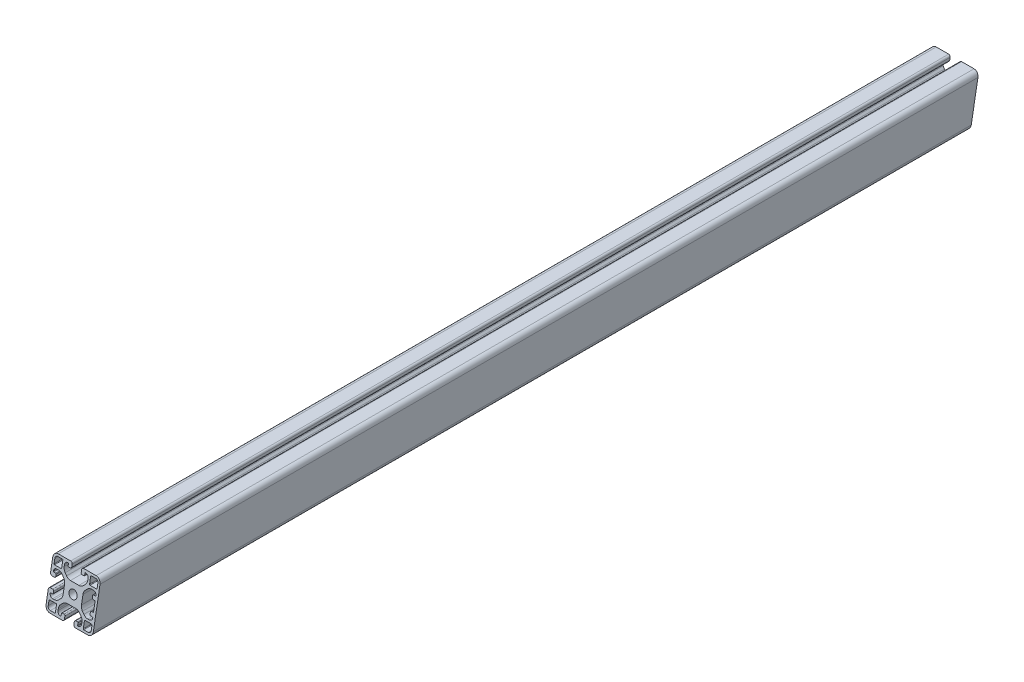
from build123d import *

# Parameters (mm, degrees)
SCHIZZO1_R                   = 3.4
ESTRUSIONE_ESTRUSIONE1_DEPTH = 750
TAGLIO_ESTRUSIONE4_DEPTH     = 413.431812546


with BuildPart() as part:
    # Schizzo1 → Estrusione-Estrusione1 (new body)
    with BuildSketch(Plane(origin=(0, 0, -340), x_dir=(-1, 0, 0), z_dir=(0, 0, -1))):
        with BuildLine():
            Line((6.5, -15.5), (5, -15.5))
            ThreePointArc((5, -15.5), (4.292893219, -15.792893219), (4, -16.5))
            Line((4, -16.5), (4, -18.5))
            ThreePointArc((4, -18.5), (4.439339828, -19.560660172), (5.5, -20))
            Line((5.5, -20), (16, -20))
            ThreePointArc((16, -20), (18.828427125, -18.828427125), (20, -16))
            Line((20, -16), (20, -5.5))
            ThreePointArc((20, -5.5), (19.560660172, -4.439339828), (18.5, -4))
            Line((18.5, -4), (16.5, -4))
            ThreePointArc((16.5, -4), (15.792893219, -4.292893219), (15.5, -5))
            Line((15.5, -5), (15.5, -6.5))
            ThreePointArc((15.5, -6.5), (15.646446609, -6.853553391), (16, -7))
            Line((16, -7), (17.55, -7))
            ThreePointArc((17.55, -7), (17.868198052, -7.131801948), (18, -7.45))
            Line((18, -7.45), (18, -7.5))
            ThreePointArc((18, -7.5), (17.267766953, -9.267766953), (15.5, -10))
            Line((15.5, -10), (14.192388155, -10))
            ThreePointArc((14.192388155, -10), (12.278970994, -9.619397663), (10.656854249, -8.535533906))
            Line((10.656854249, -8.535533906), (9.214466094, -7.09314575))
            ThreePointArc((9.214466094, -7.09314575), (8.130602337, -5.471029006), (7.75, -3.557611845))
            Line((7.75, -3.557611845), (7.75, 3.557611845))
            ThreePointArc((7.75, 3.557611845), (8.130602337, 5.471029006), (9.214466094, 7.09314575))
            Line((9.214466094, 7.09314575), (10.656854249, 8.535533906))
            ThreePointArc((10.656854249, 8.535533906), (12.278970994, 9.619397663), (14.192388155, 10))
            Line((14.192388155, 10), (15.5, 10))
            ThreePointArc((15.5, 10), (17.267766953, 9.267766953), (18, 7.5))
            Line((18, 7.5), (18, 7.45))
            ThreePointArc((18, 7.45), (17.868198052, 7.131801948), (17.55, 7))
            Line((17.55, 7), (16, 7))
            ThreePointArc((16, 7), (15.646446609, 6.853553391), (15.5, 6.5))
            Line((15.5, 6.5), (15.5, 5))
            ThreePointArc((15.5, 5), (15.792893219, 4.292893219), (16.5, 4))
            Line((16.5, 4), (18.5, 4))
            ThreePointArc((18.5, 4), (19.560660172, 4.439339828), (20, 5.5))
            Line((20, 5.5), (20, 16))
            ThreePointArc((20, 16), (18.828427125, 18.828427125), (16, 20))
            Line((16, 20), (5.5, 20))
            ThreePointArc((5.5, 20), (4.439339828, 19.560660172), (4, 18.5))
            Line((4, 18.5), (4, 16.5))
            ThreePointArc((4, 16.5), (4.292893219, 15.792893219), (5, 15.5))
            Line((5, 15.5), (6.5, 15.5))
            ThreePointArc((6.5, 15.5), (6.853553391, 15.646446609), (7, 16))
            Line((7, 16), (7, 17.55))
            ThreePointArc((7, 17.55), (7.131801948, 17.868198052), (7.45, 18))
            Line((7.45, 18), (7.5, 18))
            ThreePointArc((7.5, 18), (9.267766953, 17.267766953), (10, 15.5))
            Line((10, 15.5), (10, 14.192388155))
            ThreePointArc((10, 14.192388155), (9.619397663, 12.278970994), (8.535533906, 10.656854249))
            Line((8.535533906, 10.656854249), (7.09314575, 9.214466094))
            ThreePointArc((7.09314575, 9.214466094), (5.471029006, 8.130602337), (3.557611844, 7.75))
            Line((3.557611844, 7.75), (-3.557611845, 7.75))
            ThreePointArc((-3.557611845, 7.75), (-5.471029006, 8.130602337), (-7.09314575, 9.214466094))
            Line((-7.09314575, 9.214466094), (-8.535533906, 10.656854249))
            ThreePointArc((-8.535533906, 10.656854249), (-9.619397663, 12.278970994), (-10, 14.192388155))
            Line((-10, 14.192388155), (-10, 15.5))
            ThreePointArc((-10, 15.5), (-9.267766953, 17.267766953), (-7.5, 18))
            Line((-7.5, 18), (-7.45, 18))
            ThreePointArc((-7.45, 18), (-7.131801948, 17.868198052), (-7, 17.55))
            Line((-7, 17.55), (-7, 16))
            ThreePointArc((-7, 16), (-6.853553391, 15.646446609), (-6.5, 15.5))
            Line((-6.5, 15.5), (-5, 15.5))
            ThreePointArc((-5, 15.5), (-4.292893219, 15.792893219), (-4, 16.5))
            Line((-4, 16.5), (-4, 18.5))
            ThreePointArc((-4, 18.5), (-4.439339828, 19.560660172), (-5.5, 20))
            Line((-5.5, 20), (-16, 20))
            ThreePointArc((-16, 20), (-18.828427125, 18.828427125), (-20, 16))
            Line((-20, 16), (-20, -16))
            ThreePointArc((-20, -16), (-18.828427125, -18.828427125), (-16, -20))
            Line((-16, -20), (-5.5, -20))
            ThreePointArc((-5.5, -20), (-4.439339828, -19.560660172), (-4, -18.5))
            Line((-4, -18.5), (-4, -16.5))
            ThreePointArc((-4, -16.5), (-4.292893219, -15.792893219), (-5, -15.5))
            Line((-5, -15.5), (-6.5, -15.5))
            ThreePointArc((-6.5, -15.5), (-6.853553391, -15.646446609), (-7, -16))
            Line((-7, -16), (-7, -17.55))
            ThreePointArc((-7, -17.55), (-7.131801948, -17.868198052), (-7.45, -18))
            Line((-7.45, -18), (-7.5, -18))
            ThreePointArc((-7.5, -18), (-9.267766953, -17.267766953), (-10, -15.5))
            Line((-10, -15.5), (-10, -14.192388155))
            ThreePointArc((-10, -14.192388155), (-9.619397663, -12.278970994), (-8.535533906, -10.656854249))
            Line((-8.535533906, -10.656854249), (-7.09314575, -9.214466094))
            ThreePointArc((-7.09314575, -9.214466094), (-5.471029006, -8.130602337), (-3.557611845, -7.75))
            Line((-3.557611845, -7.75), (3.557611845, -7.75))
            ThreePointArc((3.557611845, -7.75), (5.471029006, -8.130602337), (7.09314575, -9.214466094))
            Line((7.09314575, -9.214466094), (8.535533906, -10.656854249))
            ThreePointArc((8.535533906, -10.656854249), (9.619397663, -12.278970994), (10, -14.192388155))
            Line((10, -14.192388155), (10, -15.5))
            ThreePointArc((10, -15.5), (9.267766953, -17.267766953), (7.5, -18))
            Line((7.5, -18), (7.45, -18))
            ThreePointArc((7.45, -18), (7.131801948, -17.868198052), (7, -17.55))
            Line((7, -17.55), (7, -16))
            ThreePointArc((7, -16), (6.853553391, -15.646446609), (6.5, -15.5))
        make_face()
        with Locations(Location((0, 0, 0), (0, 0, 180))):
            Circle(SCHIZZO1_R, mode=Mode.SUBTRACT)
        with BuildLine():
            Line((-12.3, -18.2), (-16, -18.2))
            ThreePointArc((-16, -18.2), (-17.555634919, -17.555634919), (-18.2, -16))
            Line((-18.2, -16), (-18.2, -12.3))
            ThreePointArc((-18.2, -12.3), (-18.053553391, -11.946446609), (-17.7, -11.8))
            Line((-17.7, -11.8), (-12.3, -11.8))
            ThreePointArc((-12.3, -11.8), (-11.946446609, -11.946446609), (-11.8, -12.3))
            Line((-11.8, -12.3), (-11.8, -17.7))
            ThreePointArc((-11.8, -17.7), (-11.946446609, -18.053553391), (-12.3, -18.2))
        make_face(mode=Mode.SUBTRACT)
        with BuildLine():
            Line((-11.8, 17.7), (-11.8, 12.3))
            ThreePointArc((-11.8, 12.3), (-11.946446609, 11.946446609), (-12.3, 11.8))
            Line((-12.3, 11.8), (-17.7, 11.8))
            ThreePointArc((-17.7, 11.8), (-18.053553391, 11.946446609), (-18.2, 12.3))
            Line((-18.2, 12.3), (-18.2, 16))
            ThreePointArc((-18.2, 16), (-17.555634919, 17.555634919), (-16, 18.2))
            Line((-16, 18.2), (-12.3, 18.2))
            ThreePointArc((-12.3, 18.2), (-11.946446609, 18.053553391), (-11.8, 17.7))
        make_face(mode=Mode.SUBTRACT)
        with BuildLine():
            Line((18.2, 16), (18.2, 12.3))
            ThreePointArc((18.2, 12.3), (18.053553391, 11.946446609), (17.7, 11.8))
            Line((17.7, 11.8), (12.3, 11.8))
            ThreePointArc((12.3, 11.8), (11.946446609, 11.946446609), (11.8, 12.3))
            Line((11.8, 12.3), (11.8, 17.7))
            ThreePointArc((11.8, 17.7), (11.946446609, 18.053553391), (12.3, 18.2))
            Line((12.3, 18.2), (16, 18.2))
            ThreePointArc((16, 18.2), (17.555634919, 17.555634919), (18.2, 16))
        make_face(mode=Mode.SUBTRACT)
        with BuildLine():
            Line((18.2, -12.3), (18.2, -16))
            ThreePointArc((18.2, -16), (17.555634919, -17.555634919), (16, -18.2))
            Line((16, -18.2), (12.3, -18.2))
            ThreePointArc((12.3, -18.2), (11.946446609, -18.053553391), (11.8, -17.7))
            Line((11.8, -17.7), (11.8, -12.3))
            ThreePointArc((11.8, -12.3), (11.946446609, -11.946446609), (12.3, -11.8))
            Line((12.3, -11.8), (17.7, -11.8))
            ThreePointArc((17.7, -11.8), (18.053553391, -11.946446609), (18.2, -12.3))
        make_face(mode=Mode.SUBTRACT)
        with BuildLine():
            Line((-16, 7), (-17.5, 7))
            ThreePointArc((-17.5, 7), (-17.853553391, 7.146446609), (-18, 7.5))
            ThreePointArc((-18, 7.5), (-17.267766953, 9.267766953), (-15.5, 10))
            Line((-15.5, 10), (-14.192388155, 10))
            ThreePointArc((-14.192388155, 10), (-12.278970994, 9.619397663), (-10.656854249, 8.535533906))
            Line((-10.656854249, 8.535533906), (-9.214466094, 7.093145751))
            ThreePointArc((-9.214466094, 7.093145751), (-8.130602337, 5.471029006), (-7.75, 3.557611845))
            Line((-7.75, 3.557611845), (-7.75, -3.557611845))
            ThreePointArc((-7.75, -3.557611845), (-8.130602337, -5.471029006), (-9.214466094, -7.093145751))
            Line((-9.214466094, -7.093145751), (-10.656854249, -8.535533906))
            ThreePointArc((-10.656854249, -8.535533906), (-12.278970994, -9.619397663), (-14.192388155, -10))
            Line((-14.192388155, -10), (-15.5, -10))
            ThreePointArc((-15.5, -10), (-17.267766953, -9.267766953), (-18, -7.5))
            ThreePointArc((-18, -7.5), (-17.853553391, -7.146446609), (-17.5, -7))
            Line((-17.5, -7), (-16, -7))
            ThreePointArc((-16, -7), (-15.646446609, -6.853553391), (-15.5, -6.5))
            Line((-15.5, -6.5), (-15.5, -5))
            ThreePointArc((-15.5, -5), (-15.792893219, -4.292893219), (-16.5, -4))
            Line((-16.5, -4), (-17.5, -4))
            ThreePointArc((-17.5, -4), (-17.853553391, -3.853553391), (-18, -3.5))
            Line((-18, -3.5), (-18, 3.5))
            ThreePointArc((-18, 3.5), (-17.853553391, 3.853553391), (-17.5, 4))
            Line((-17.5, 4), (-16.5, 4))
            ThreePointArc((-16.5, 4), (-15.792893219, 4.292893219), (-15.5, 5))
            Line((-15.5, 5), (-15.5, 6.5))
            ThreePointArc((-15.5, 6.5), (-15.646446609, 6.853553391), (-16, 7))
        make_face(mode=Mode.SUBTRACT)
    extrude(amount=-ESTRUSIONE_ESTRUSIONE1_DEPTH)

    # Schizzo9 → Taglio-Estrusione4 (cut, through all)
    with BuildSketch(Plane(origin=(20, 0, 0), x_dir=(0, 0, -1), z_dir=(1, 0, 0))):
        Polygon((340, -20), (340, 20), (332.946920772, -20), align=None)
        Polygon((-410, -20), (-402.9462698, 20), (-410, 20), align=None)
    extrude(amount=-TAGLIO_ESTRUSIONE4_DEPTH, mode=Mode.SUBTRACT)


solid = part.part
